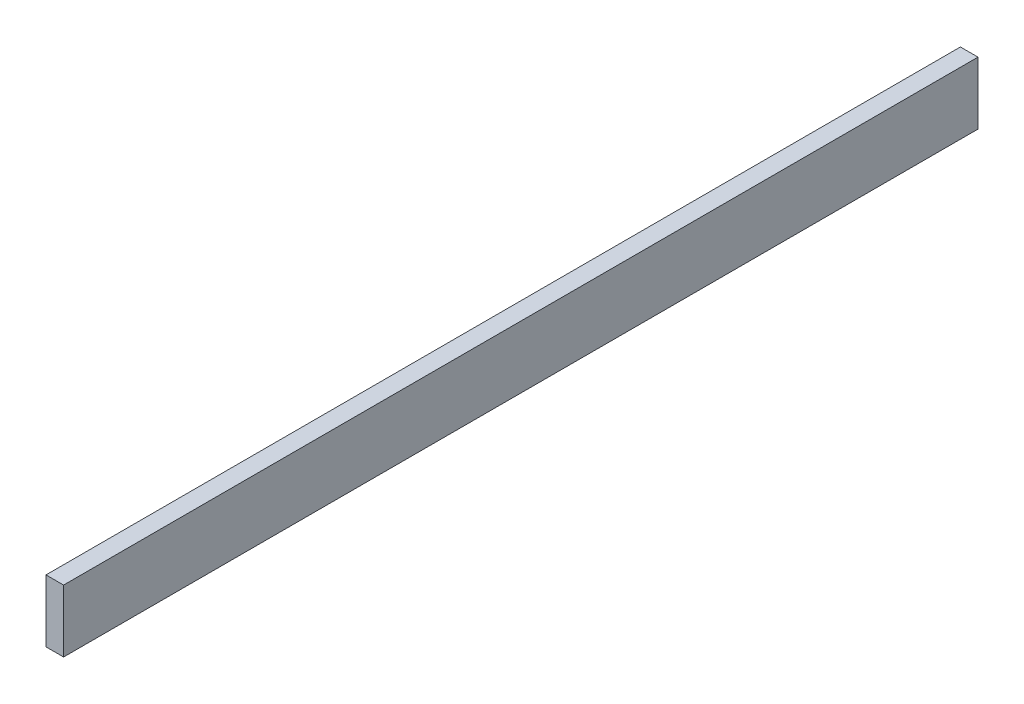
from build123d import *

# Parameters (mm, degrees)
SKETCH1_W                          = 12.7
SKETCH1_H                          = 45
CEK_TAZE_RAY_IC_PROFIL_SAG_1_DEPTH = 660


with BuildPart() as part:
    # Sketch1 → CEK_taze_ray_ic_profil_sag_1 (new body)
    with BuildSketch(Plane.XY):
        with Locations((611.65, 40.5)):
            Rectangle(SKETCH1_W, SKETCH1_H)
    extrude(amount=-CEK_TAZE_RAY_IC_PROFIL_SAG_1_DEPTH)


solid = part.part
